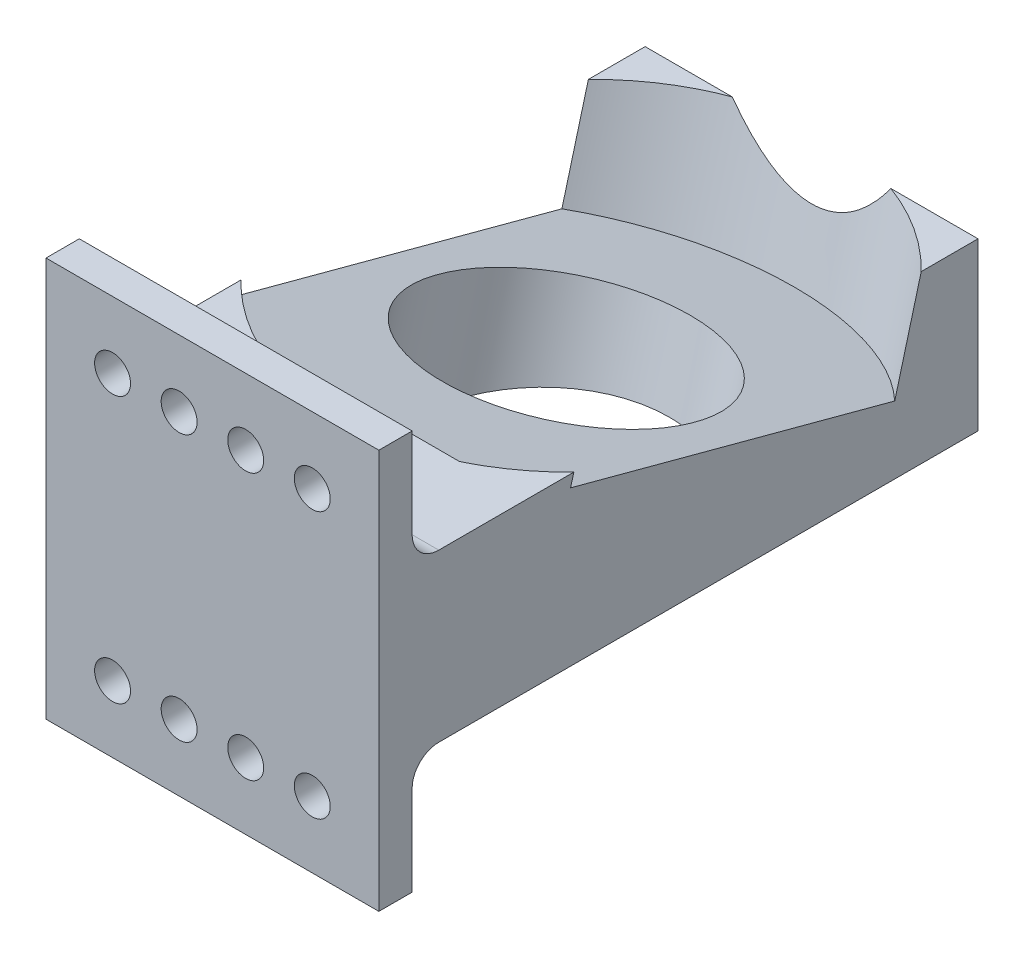
from build123d import *

# Parameters (mm, degrees)
SKETCH1_W           = 107.95
SKETCH1_H           = 31.75
BOSS_EXTRUDE1_DEPTH = 31.75
SKETCH3_W           = 63.5
SKETCH3_H           = 76.2
SKETCH3_R           = 3.429
BOSS_EXTRUDE2_DEPTH = 6.35
FILLET1_R           = 5.08


with BuildPart() as part:
    # Sketch1 → Boss-Extrude1 (new, symmetric)
    with BuildSketch(Plane(origin=(0, 0, 0), x_dir=(0, 0, -1), z_dir=(1, 0, 0))):
        Rectangle(SKETCH1_W, SKETCH1_H)
    extrude(amount=BOSS_EXTRUDE1_DEPTH, both=True)

    # Sketch2 → Cut-Revolve1 (revolve, cut)
    with BuildSketch(Plane(origin=(0, 0, 0), x_dir=(0, 0, -1), z_dir=(1, 0, 0))):
        Polygon((30.787113889, -1.024256513), (21.709471638, -34.902478605), (-1.905, -28.575), (15.934173595, 38.001702221), (59.482939473, 26.332845573), (50.721408129, -6.365634557), align=None)
    revolve(axis=Axis((0, -21.465443212, 0), (0, 0.9659258262890701, -0.2588190451025143)), mode=Mode.SUBTRACT)

    # Sketch3 → Boss-Extrude2 (add)
    with BuildSketch(Plane.XY.offset(53.975)):
        Rectangle(SKETCH3_W, SKETCH3_H)
        with Locations((-19.05, 25.4)):
            Circle(SKETCH3_R, mode=Mode.SUBTRACT)
        with Locations((-6.35, 25.4)):
            Circle(SKETCH3_R, mode=Mode.SUBTRACT)
        with Locations((6.35, 25.4)):
            Circle(SKETCH3_R, mode=Mode.SUBTRACT)
        with Locations((19.05, 25.4)):
            Circle(SKETCH3_R, mode=Mode.SUBTRACT)
        with Locations((-6.35, -25.4)):
            Circle(SKETCH3_R, mode=Mode.SUBTRACT)
        with Locations((6.35, -25.4)):
            Circle(SKETCH3_R, mode=Mode.SUBTRACT)
        with Locations((19.05, -25.4)):
            Circle(SKETCH3_R, mode=Mode.SUBTRACT)
        with Locations((-19.05, -25.4)):
            Circle(SKETCH3_R, mode=Mode.SUBTRACT)
    extrude(amount=BOSS_EXTRUDE2_DEPTH)

    # Fillet1
    fillet1_edges = [part.edges().sort_by_distance(p)[0] for p in [
        (0, 15.875, 53.975),
        (0, -15.875, 53.975),
    ]]
    fillet(fillet1_edges, radius=FILLET1_R)


solid = part.part
